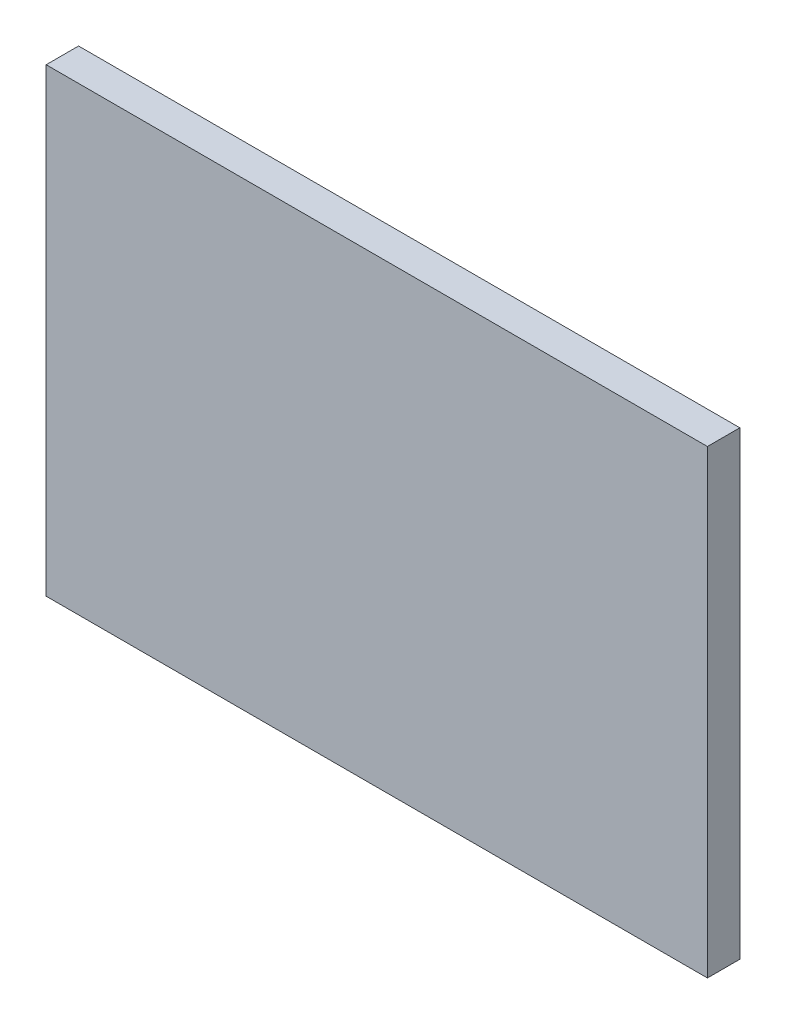
from build123d import *

# Parameters (mm, degrees)
SKETCH1_W           = 102
SKETCH1_H           = 71
BOSS_EXTRUDE1_DEPTH = 5


with BuildPart() as part:
    # Sketch1 → Boss-Extrude1 (new body)
    with BuildSketch(Plane.XY):
        Rectangle(SKETCH1_W, SKETCH1_H)
    extrude(amount=BOSS_EXTRUDE1_DEPTH)


solid = part.part
